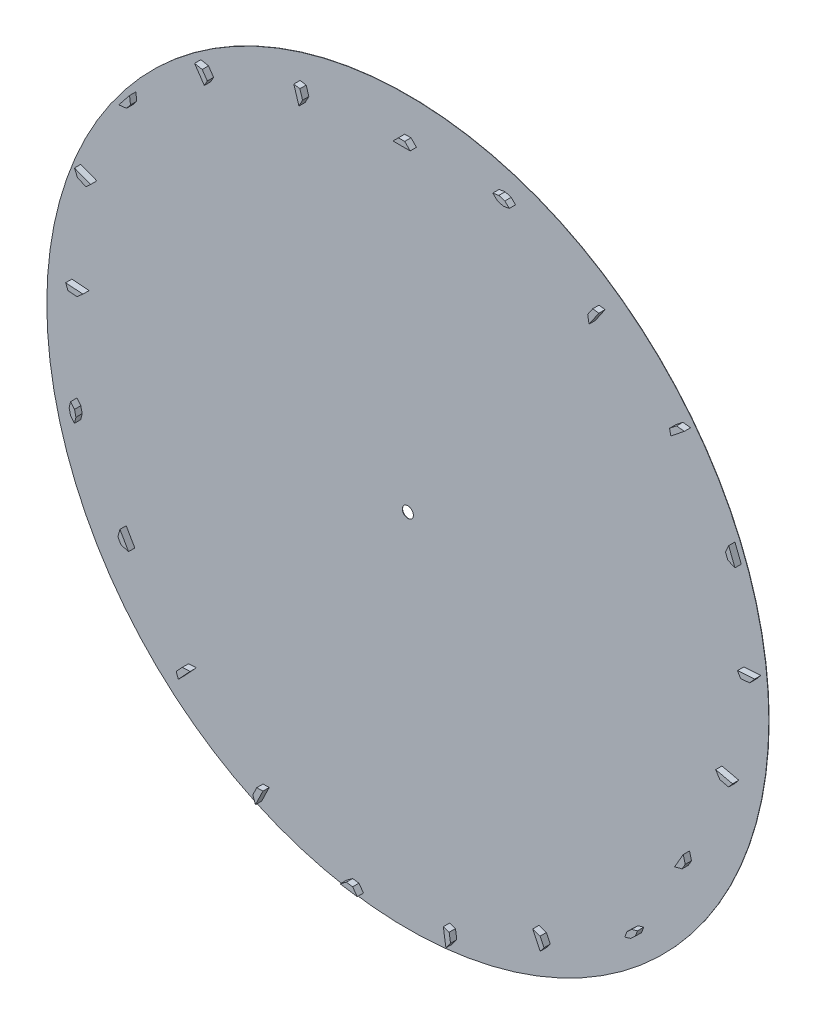
from build123d import *

# Parameters (mm, degrees)
SKETCH1_R           = 115
SKETCH1_R_2         = 1.75
BOSS_EXTRUDE1_DEPTH = 0.1
BOSS_EXTRUDE2_DEPTH = 2


with BuildPart() as part:
    # Sketch1 → Boss-Extrude1 (new body)
    with BuildSketch(Plane.XY):
        Circle(SKETCH1_R)
        Circle(SKETCH1_R_2, mode=Mode.SUBTRACT)
    extrude(amount=BOSS_EXTRUDE1_DEPTH)

    # Sketch2 → Boss-Extrude2 (add)
    with BuildSketch(Plane.XY.offset(0.1)):
        Polygon((2.75, 102), (1, 103.75), (-1, 103.75), (-2.75, 102), align=None)
        Polygon((-31.536422151, 98.845923426), (-32.692853006, 96.657849461), (-34.314006465, 101.913499892), (-32.383843277, 101.593195243), align=None)
        Polygon((-61.876050067, 88.980307108), (-62.829062871, 87.271538079), (-65.927323191, 91.815851338), (-63.495595234, 91.355743585), align=None)
        Polygon((-86.355262623, 70.145071939), (-87.602242226, 68.581408974), (-90.061554474, 68.304311033), (-86.632360564, 72.604384187), align=None)
        Polygon((-104.18404578, 43.843438562), (-103.194363512, 41.575062709), (-100.518101485, 40.524707264), (-99.064240162, 41.834062928), align=None)
        Polygon((-106.252124781, 8.965300026), (-106.99390044, 10.775795503), (-101.509279555, 10.364779988), (-103.385163864, 8.750451007), align=None)
        Polygon((-105.416683128, -21.239948642), (-105.880333417, -23.140778305), (-105.435291549, -25.09063413), (-104.192817991, -26.602052159), (-103.729167702, -24.701222495), (-104.17420957, -22.751366671), align=None)
        Polygon((-86.959591186, -53.38156986), (-89.709591186, -48.61843014), (-90.350135643, -51.008974596), (-89.350135643, -52.741025404), align=None)
        Polygon((-69.834869672, -76.73430444), (-67.361726605, -76.641765956), (-71.102676663, -80.673551251), (-71.790366293, -78.841828572), align=None)
        Polygon((-46.121181359, -98.076384798), (-44.164837568, -98.047333582), (-46.551198134, -103.002662356), (-47.368597109, -100.666670293), align=None)
        Polygon((-17.569782938, -109.858387151), (-15.592121286, -110.156471684), (-14.122491306, -112.147749595), (-19.56106085, -111.328017131), align=None)
        Polygon((14.122491306, -112.147749595), (15.592121286, -110.156471684), (15.163624771, -107.313583058), (13.302758842, -106.709180051), align=None)
        Polygon((45.361884816, -96.499689279), (44.164837568, -98.047333582), (41.778477003, -93.092004809), (44.114469066, -93.909403784), align=None)
        Polygon((71.102676663, -80.673551251), (72.980668584, -80.124669347), (74.446772328, -78.764323872), (75.134461958, -76.932601193), (73.256470037, -77.481483096), (71.790366293, -78.841828572), align=None)
        Polygon((89.709591186, -48.61843014), (86.959591186, -53.38156986), (89.350135643, -52.741025404), (90.350135643, -51.008974596), align=None)
        Polygon((101.371291823, -22.111618986), (100.054579611, -20.016083505), (105.416683128, -21.239948642), (104.17420957, -22.751366671), align=None)
        Polygon((107.997231426, 9.09607769), (106.99390044, 10.775795503), (112.478521324, 11.186811018), (110.864192343, 9.310926709), align=None)
        Polygon((103.925045561, 39.713315212), (103.194363512, 41.575062709), (104.18404578, 43.843438562), (106.193421414, 38.723632945), align=None)
        Polygon((90.061554474, 68.304311033), (87.602242226, 68.581408974), (85.354476714, 66.788875794), (85.76148132, 64.875117123), align=None)
        Polygon((60.890239965, 87.534389253), (62.829062871, 87.271538079), (59.730802552, 82.727224821), (59.270694798, 85.158952777), align=None)
        Polygon((34.314006465, 101.913499892), (32.899664833, 103.265447653), (30.988519221, 103.854958001), (29.058356033, 103.534653352), (30.472697666, 102.182705591), (32.383843277, 101.593195243), align=None)
    extrude(amount=BOSS_EXTRUDE2_DEPTH)


solid = part.part
